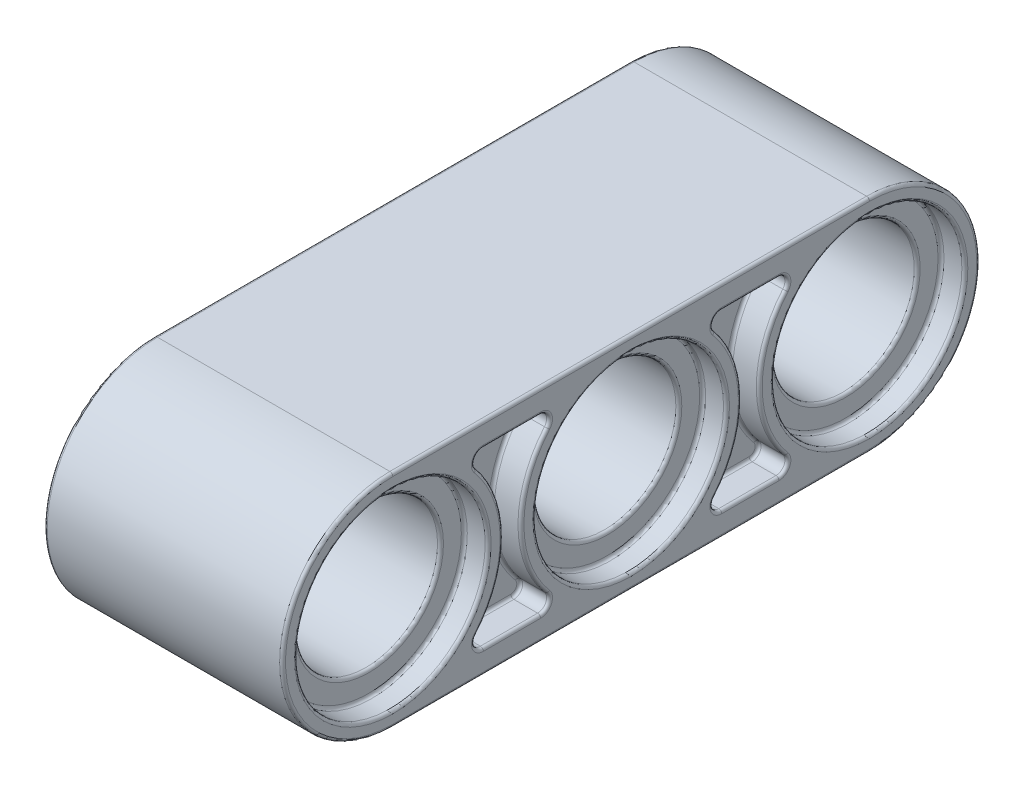
from build123d import *

# Parameters (mm, degrees)
SKETCH1_R           = 2.4
BOSS_EXTRUDE1_DEPTH = 8
SKETCH2_R           = 3.2
CUT_EXTRUDE1_DEPTH  = 0.8
CUT_EXTRUDE2_START  = -1
CUT_EXTRUDE2_DEPTH  = 1
FILLET1_R           = 0.1


with BuildPart() as part:
    # Sketch1 → Boss-Extrude1 (new body)
    with BuildSketch(Plane(origin=(0, 0, 0), x_dir=(0, 0, -1), z_dir=(1, 0, 0))):
        with BuildLine():
            Line((-5.732394366, 3.7), (10.267605634, 3.7))
            ThreePointArc((10.267605634, 3.7), (13.967605634, 0), (10.267605634, -3.7))
            Line((10.267605634, -3.7), (-5.732394366, -3.7))
            ThreePointArc((-5.732394366, -3.7), (-9.432394366, 0), (-5.732394366, 3.7))
        make_face()
        with Locations((-5.732394366, 0)):
            Circle(SKETCH1_R, mode=Mode.SUBTRACT)
        with Locations((2.267605634, 0)):
            Circle(SKETCH1_R, mode=Mode.SUBTRACT)
        with Locations((10.267605634, 0)):
            Circle(SKETCH1_R, mode=Mode.SUBTRACT)
    extrude(amount=BOSS_EXTRUDE1_DEPTH)

    # Sketch2 → Cut-Extrude1 (cut)
    with BuildSketch(Plane(origin=(8, 0, 0), x_dir=(0, 0, -1), z_dir=(1, 0, 0))):
        with Locations((-5.732394366, 0)):
            Circle(SKETCH2_R)
        with Locations((2.267605634, 0)):
            Circle(SKETCH2_R)
        with Locations((10.267605634, 0)):
            Circle(SKETCH2_R)
    cut_extrude1 = extrude(amount=-CUT_EXTRUDE1_DEPTH, mode=Mode.SUBTRACT)

    # Sketch3 → Cut-Extrude2 (cut)
    with BuildSketch(Plane(origin=(8, 0, 0), x_dir=(0, 0, -1), z_dir=(1, 0, 0)).offset(CUT_EXTRUDE2_START)):
        with BuildLine():
            Line((-2.692657535, 2.9), (-0.772131197, 2.9))
            ThreePointArc((-0.772131197, 2.9), (-0.499642665, 2.725499004), (-0.544150935, 2.405))
            ThreePointArc((-0.544150935, 2.405), (-1.432394366, 0), (-0.544150935, -2.405))
            ThreePointArc((-0.544150935, -2.405), (-0.499642665, -2.725499004), (-0.772131197, -2.9))
            Line((-0.772131197, -2.9), (-2.692657535, -2.9))
            ThreePointArc((-2.692657535, -2.9), (-2.965146067, -2.725499004), (-2.920637798, -2.405))
            ThreePointArc((-2.920637798, -2.405), (-2.032394366, 0), (-2.920637798, 2.405))
            ThreePointArc((-2.920637798, 2.405), (-2.965146067, 2.725499004), (-2.692657535, 2.9))
        make_face()
        with BuildLine():
            Line((5.307342465, 2.9), (7.227868803, 2.9))
            ThreePointArc((7.227868803, 2.9), (7.500357335, 2.725499004), (7.455849065, 2.405))
            ThreePointArc((7.455849065, 2.405), (6.567605634, 0), (7.455849065, -2.405))
            ThreePointArc((7.455849065, -2.405), (7.500357335, -2.725499004), (7.227868803, -2.9))
            Line((7.227868803, -2.9), (5.307342465, -2.9))
            ThreePointArc((5.307342465, -2.9), (5.034853933, -2.725499004), (5.079362202, -2.405))
            ThreePointArc((5.079362202, -2.405), (5.967605634, 0), (5.079362202, 2.405))
            ThreePointArc((5.079362202, 2.405), (5.034853933, 2.725499004), (5.307342465, 2.9))
        make_face()
    cut_extrude2 = extrude(amount=CUT_EXTRUDE2_DEPTH, mode=Mode.SUBTRACT)

    # Mirror1: Cut-Extrude1, Cut-Extrude2 across plane
    add(cut_extrude1.mirror(Plane(origin=(4, 0, 0), x_dir=(0, 0, 1), z_dir=(1, 0, 0))), mode=Mode.SUBTRACT)
    add(cut_extrude2.mirror(Plane(origin=(4, 0, 0), x_dir=(0, 0, 1), z_dir=(1, 0, 0))), mode=Mode.SUBTRACT)

    # Fillet1
    fillet1_edges = [part.edges().sort_by_distance(p)[0] for p in [
        (8, 0, -13.967605634),
        (0, 0, -7.067605634),
        (0.8, 0, -7.867605634),
        (0.8, 0, -7.067605634),
        (0, -2.725499004, 2.965146067),
        (0, -2.9, 1.732394366),
        (0, -2.725499004, 0.499642665),
        (0, 0, 1.432394366),
        (0, 2.725499004, 0.499642665),
        (0, 2.9, 1.732394366),
        (0, 2.725499004, 2.965146067),
        (0, 0, 2.032394366),
        (1, -2.725499004, 2.965146067),
        (1, -2.9, 1.732394366),
        (1, -2.725499004, 0.499642665),
        (1, 0, 1.432394366),
        (1, 2.725499004, 0.499642665),
        (1, 2.9, 1.732394366),
        (1, 2.725499004, 2.965146067),
        (1, 0, 2.032394366),
        (0, -2.725499004, -5.034853933),
        (0, -2.9, -6.267605634),
        (8, 3.7, -2.267605634),
        (0, -2.725499004, -7.500357335),
        (0, 0, -6.567605634),
        (0, 2.725499004, -7.500357335),
        (0, 2.9, -6.267605634),
        (0, 2.725499004, -5.034853933),
        (0, 0, -5.967605634),
        (1, -2.725499004, -5.034853933),
        (1, -2.9, -6.267605634),
        (1, -2.725499004, -7.500357335),
        (1, 0, -6.567605634),
        (1, 2.725499004, -7.500357335),
        (1, 2.9, -6.267605634),
        (1, 2.725499004, -5.034853933),
        (1, 0, -5.967605634),
        (7.2, 0, 8.932394366),
        (7.2, 0, 8.132394366),
        (8, 0, 8.932394366),
        (7.2, 0, 0.932394366),
        (7.2, 0, 0.132394366),
        (8, 0, 0.932394366),
        (7.2, 0, -7.067605634),
        (7.2, 0, -7.867605634),
        (8, 0, -7.067605634),
        (8, 0, 9.432394366),
        (0, 3.7, -2.267605634),
        (7, -2.725499004, 2.965146067),
        (7, 0, 2.032394366),
        (7, 2.725499004, 2.965146067),
        (0, 0, -13.967605634),
        (7, 2.9, 1.732394366),
        (7, 2.725499004, 0.499642665),
        (7, 0, 1.432394366),
        (7, -2.725499004, 0.499642665),
        (7, -2.9, 1.732394366),
        (8, -2.725499004, 2.965146067),
        (8, -2.9, 1.732394366),
        (8, -2.725499004, 0.499642665),
        (8, 0, 1.432394366),
        (8, 2.725499004, 0.499642665),
        (8, 2.9, 1.732394366),
        (0, -3.7, -2.267605634),
        (8, 2.725499004, 2.965146067),
        (8, 0, 2.032394366),
        (0, 0, 9.432394366),
        (7, -2.725499004, -5.034853933),
        (7, 0, -5.967605634),
        (7, 2.725499004, -5.034853933),
        (7, 2.9, -6.267605634),
        (7, 2.725499004, -7.500357335),
        (8, -3.7, -2.267605634),
        (7, 0, -6.567605634),
        (7, -2.725499004, -7.500357335),
        (7, -2.9, -6.267605634),
        (8, -2.725499004, -5.034853933),
        (8, -2.9, -6.267605634),
        (8, -2.725499004, -7.500357335),
        (8, 0, -6.567605634),
        (8, 2.725499004, -7.500357335),
        (8, 2.9, -6.267605634),
        (8, 2.725499004, -5.034853933),
        (8, 0, -5.967605634),
        (0, 0, 8.932394366),
        (0.8, 0, 8.132394366),
        (0.8, 0, 8.932394366),
        (0, 0, 0.932394366),
        (0.8, 0, 0.132394366),
        (0.8, 0, 0.932394366),
    ]]
    fillet(fillet1_edges, radius=FILLET1_R)


solid = part.part
